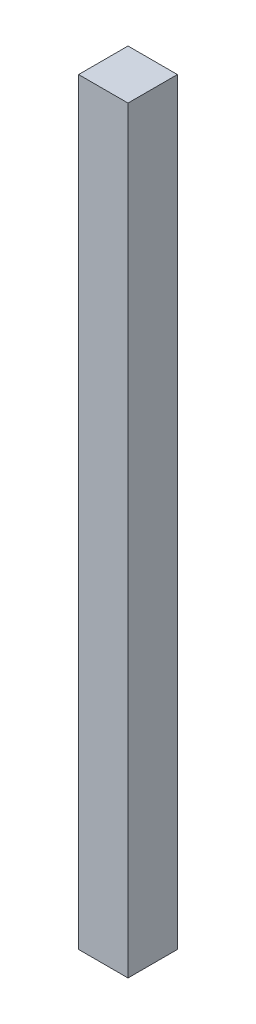
from build123d import *

# Parameters (mm, degrees)
SKETCH_1_W      = 15
SKETCH_1_H      = 15
EXTRUDE_1_DEPTH = 230


with BuildPart() as part:
    # 草图1 → 凸台-拉伸1 (new body)
    with BuildSketch(Plane(origin=(0, 0, 0), x_dir=(1, 0, 0), z_dir=(0, 1, 0))):
        Rectangle(SKETCH_1_W, SKETCH_1_H)
    extrude(amount=EXTRUDE_1_DEPTH)


solid = part.part
